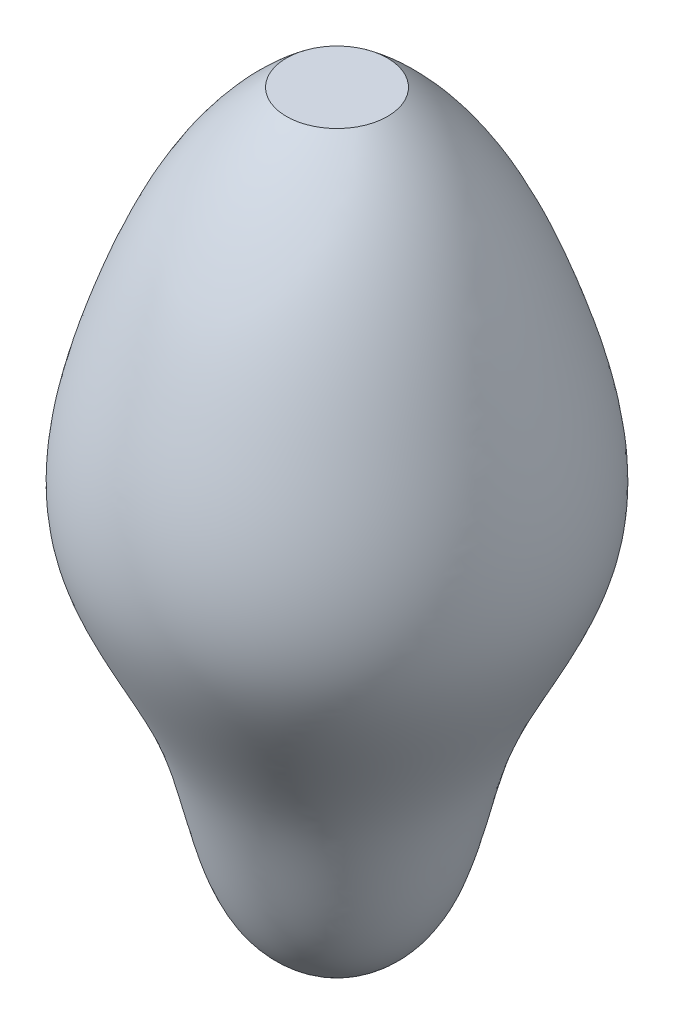
from build123d import *


with BuildPart() as part:
    # 草图1 → 旋转1 (revolve)
    with BuildSketch(Plane.XY):
        with BuildLine():
            Line((20, 300), (0, 300))
            Line((0, 300), (0, 0))
            add(Edge.make_bspline(
                [(0, 0), (40.507859194, 9.405845809), (37.024840646, 77.059409949), (90.985306991, 145.770300316), (69.376626103, 230.001602705), (45.86767777, 279.872491051), (20, 300)],
                knots=[0, 0, 0, 0, 0.290748642, 0.513734737, 0.720772128, 1, 1, 1, 1], degree=3))
        make_face()
    revolve(axis=Axis((0, 0, 0), (0, 1, 0)))


solid = part.part
